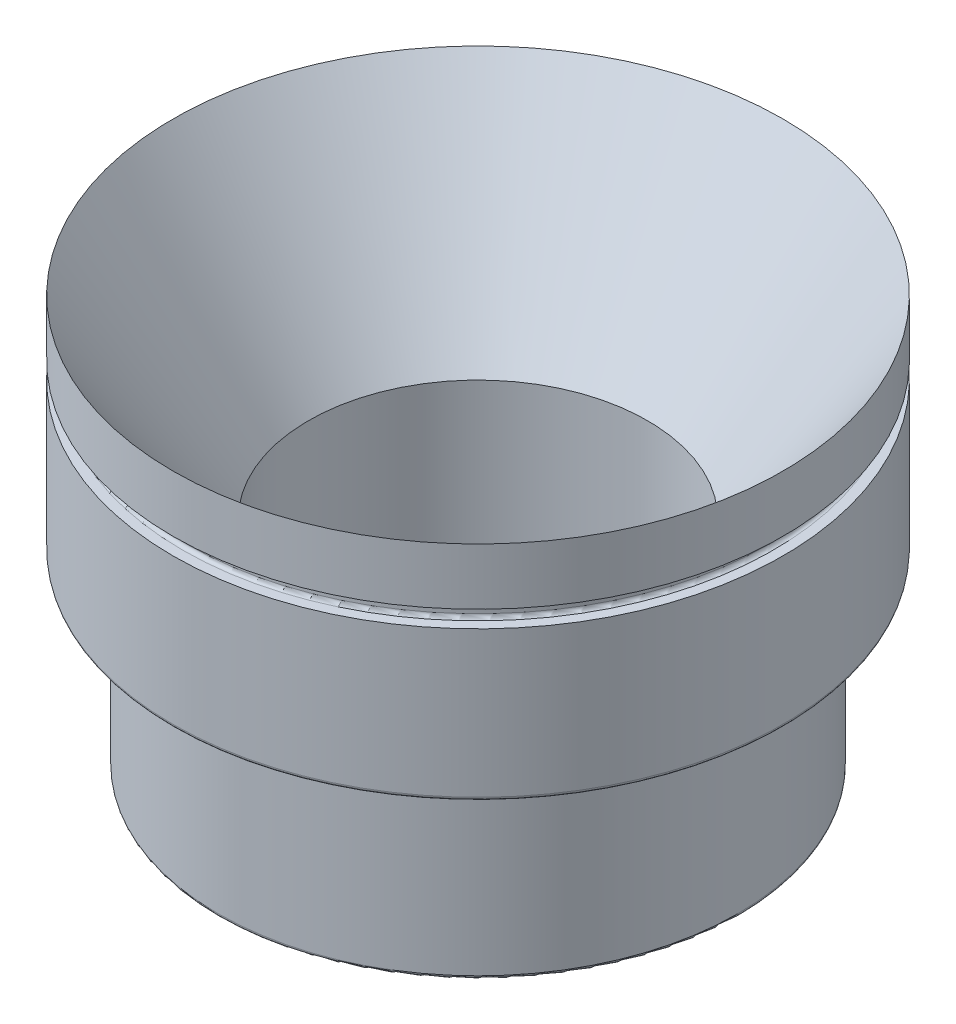
from build123d import *

# Parameters (mm, degrees)
SKETCH6_W     = 1.5113
SKETCH6_H     = 1.905
TOOL_RADIUS_R = 0.4064


with BuildPart() as part:
    # Sketch4 → Revolve1 (revolve)
    with BuildSketch(Plane(origin=(0, 0, 0), x_dir=(0, 0, -1), z_dir=(1, 0, 0)), mode=Mode.PRIVATE) as revolve1_sk:
        Polygon((34.2773, 0), (19.05, -21.746838143), (19.05, -38.149257502), (20.382233443, -46.030856842), (29.1846, -46.030856842), (29.1846, -25.050456842), (34.2773, -25.050456842), align=None)
    revolve(revolve1_sk.sketch.rotate(Axis((0, 0, 0), (0, -1, 0)), 180), axis=Axis((0, 0, 0), (0, -1, 0)))

    # Sketch6 → Spring Groove (revolve, cut)
    with BuildSketch(Plane(origin=(0, 0, 0), x_dir=(0, 0, -1), z_dir=(1, 0, 0)), mode=Mode.PRIVATE) as spring_groove_sk:
        with Locations((33.52165, -7.3025)):
            Rectangle(SKETCH6_W, SKETCH6_H)
    revolve(spring_groove_sk.sketch.rotate(Axis((0, 11.364369063, 0), (0, -1, 0)), 180), axis=Axis((0, 11.364369063, 0), (0, -1, 0)), mode=Mode.SUBTRACT)

    # Tool Radius
    tool_radius_edges = [part.edges().sort_by_distance(p)[0] for p in [
        (0, -6.35, -32.766),
        (0, -8.255, -32.766),
        (0, -46.030856842, -29.1846),
        (0, -25.050456842, -29.1846),
        (0, -25.050456842, -34.2773),
    ]]
    fillet(tool_radius_edges, radius=TOOL_RADIUS_R)


solid = part.part
